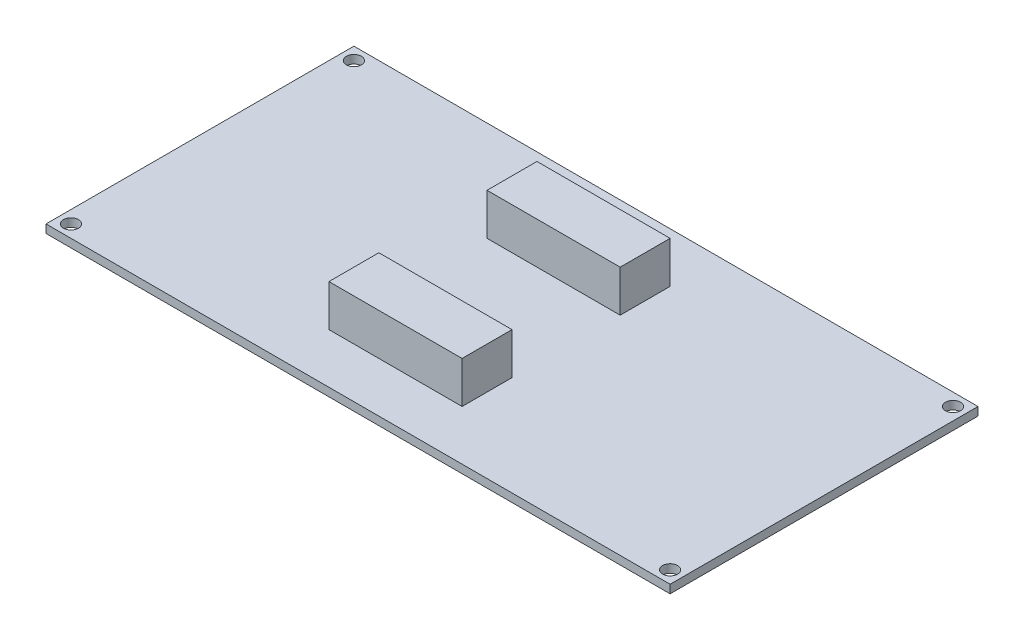
from build123d import *

# Parameters (mm, degrees)
SKETCH1_W                                  = 119.0625
SKETCH1_H                                  = 58.7375
BOSS_EXTRUDE1_DEPTH                        = 1.5875
SKETCH2_W                                  = 25.4
SKETCH2_H                                  = 9.525
BOSS_EXTRUDE2_DEPTH                        = 7.9375
SKETCH3_R                                  = 1.42875
CUT_EXTRUDE1_DEPTH                         = 67.854297613
MIRROR2_AT_THE_SECOND_PLANE_COPY_1_SKETC_R = 1.42875
MIRROR2_AT_THE_SECOND_PLANE_COPY_1_DEPTH   = 67.854297613


with BuildPart() as part:
    # Sketch1 → Boss-Extrude1 (new body)
    with BuildSketch(Plane(origin=(0, 0, 0), x_dir=(1, 0, 0), z_dir=(0, 1, 0))):
        Rectangle(SKETCH1_W, SKETCH1_H)
    extrude(amount=BOSS_EXTRUDE1_DEPTH)

    # Sketch2 → Boss-Extrude2 (add)
    with BuildSketch(Plane(origin=(0, 1.5875, 0), x_dir=(1, 0, 0), z_dir=(0, 1, 0))):
        with Locations((-2.38125, -15.08125)):
            Rectangle(SKETCH2_W, SKETCH2_H)
    boss_extrude2 = extrude(amount=BOSS_EXTRUDE2_DEPTH)

    # Mirror1: Boss-Extrude2 across plane
    add(boss_extrude2.mirror(Plane.XY))

    # Sketch3 → Cut-Extrude1 (cut, through all)
    with BuildSketch(Plane(origin=(0, 1.5875, 0), x_dir=(1, 0, 0), z_dir=(0, 1, 0))):
        with Locations(Location((-57.15, -26.9875, 0), (0, 0, 270))):
            Circle(SKETCH3_R)
    cut_extrude1 = extrude(amount=-CUT_EXTRUDE1_DEPTH, mode=Mode.SUBTRACT)

    # Mirror2: Cut-Extrude1 across plane
    add(cut_extrude1.mirror(Plane(origin=(0, 0, 0), x_dir=(0, 0, 1), z_dir=(1, 0, 0))), mode=Mode.SUBTRACT)

    # Mirror2 at the second plane: Cut-Extrude1 across plane
    add(cut_extrude1.mirror(Plane.XY), mode=Mode.SUBTRACT)

    # Mirror2 at the second plane copy 1 sketc → Mirror2 at the second plane copy 1 (cut, through all)
    with BuildSketch(Plane(origin=(0, 1.5875, 0), x_dir=(-1, 0, 0), z_dir=(0, 1, 0))):
        with Locations(Location((-57.15, -26.9875, 0), (0, 0, 270))):
            Circle(MIRROR2_AT_THE_SECOND_PLANE_COPY_1_SKETC_R)
    extrude(amount=-MIRROR2_AT_THE_SECOND_PLANE_COPY_1_DEPTH, mode=Mode.SUBTRACT)


solid = part.part
